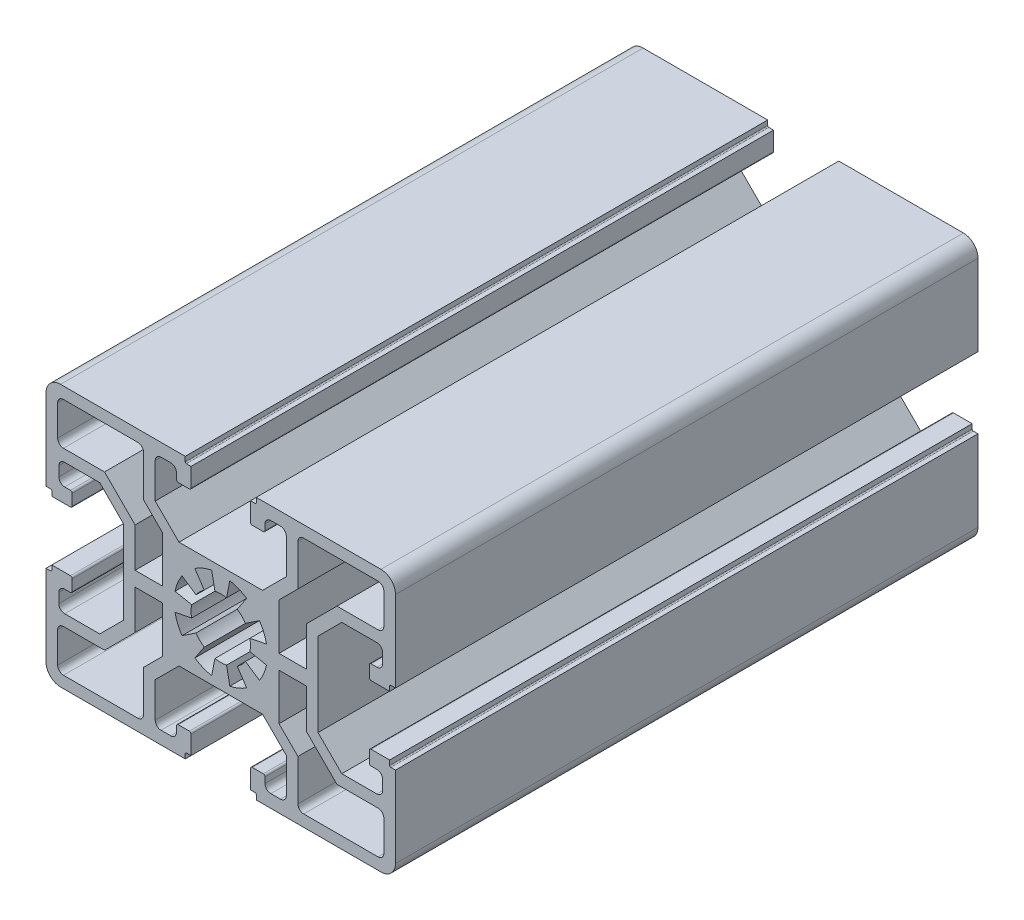
from build123d import *

# Parameters (mm, degrees)
EXTRUDE_1_DEPTH = 100


with BuildPart() as part:
    # 草图1 → 凸台-拉伸1 (new body)
    with BuildSketch(Plane.XY):
        with BuildLine():
            Line((-5.674392903, 22.651402525), (-27.074392903, 22.651402525))
            ThreePointArc((-27.074392903, 22.651402525), (-28.842159856, 21.919169478), (-29.574392903, 20.151402525))
            Line((-29.574392903, 20.151402525), (-29.574392903, 6.251402525))
            Line((-29.574392903, 6.251402525), (-28.774392903, 6.251402525))
            ThreePointArc((-28.774392903, 6.251402525), (-28.632971547, 6.192823881), (-28.574392903, 6.051402525))
            Line((-28.574392903, 6.051402525), (-28.574392903, 5.251402525))
            Line((-28.574392903, 5.251402525), (-25.374392903, 5.251402525))
            ThreePointArc((-25.374392903, 5.251402525), (-25.162260869, 5.33927049), (-25.074392903, 5.551402525))
            Line((-25.074392903, 5.551402525), (-25.074392903, 7.451402525))
            ThreePointArc((-25.074392903, 7.451402525), (-25.162260869, 7.663534559), (-25.374392903, 7.751402525))
            Line((-25.374392903, 7.751402525), (-26.374392903, 7.751402525))
            ThreePointArc((-26.374392903, 7.751402525), (-27.081499684, 8.044295743), (-27.374392903, 8.751402525))
            Line((-27.374392903, 8.751402525), (-27.374392903, 10.401402525))
            ThreePointArc((-27.374392903, 10.401402525), (-27.081499684, 11.108509306), (-26.374392903, 11.401402525))
            Line((-26.374392903, 11.401402525), (-20.352820028, 11.401402525))
            Line((-20.352820028, 11.401402525), (-16.274392903, 7.3229754))
            Line((-16.274392903, 7.3229754), (-16.274392903, 0.151402525))
            Line((-16.274392903, 0.151402525), (-16.274392903, -7.020170351))
            Line((-16.274392903, -7.020170351), (-20.352820028, -11.098597475))
            Line((-20.352820028, -11.098597475), (-26.374392903, -11.098597475))
            ThreePointArc((-26.374392903, -11.098597475), (-27.081499684, -10.805704257), (-27.374392903, -10.098597475))
            Line((-27.374392903, -10.098597475), (-27.374392903, -8.448597475))
            ThreePointArc((-27.374392903, -8.448597475), (-27.081499684, -7.741490694), (-26.374392903, -7.448597475))
            Line((-26.374392903, -7.448597475), (-25.374392903, -7.448597475))
            ThreePointArc((-25.374392903, -7.448597475), (-25.162260869, -7.36072951), (-25.074392903, -7.148597475))
            Line((-25.074392903, -7.148597475), (-25.074392903, -5.248597475))
            ThreePointArc((-25.074392903, -5.248597475), (-25.162260869, -5.036465441), (-25.374392903, -4.948597475))
            Line((-25.374392903, -4.948597475), (-28.574392903, -4.948597475))
            Line((-28.574392903, -4.948597475), (-28.574392903, -5.748597475))
            ThreePointArc((-28.574392903, -5.748597475), (-28.632971547, -5.890018832), (-28.774392903, -5.948597475))
            Line((-28.774392903, -5.948597475), (-29.574392903, -5.948597475))
            Line((-29.574392903, -5.948597475), (-29.574392903, -19.848597475))
            ThreePointArc((-29.574392903, -19.848597475), (-28.842159856, -21.616364428), (-27.074392903, -22.348597475))
            Line((-27.074392903, -22.348597475), (-5.674392903, -22.348597475))
            Line((-5.674392903, -22.348597475), (-5.674392903, -21.548597475))
            ThreePointArc((-5.674392903, -21.548597475), (-5.61581426, -21.407176119), (-5.474392903, -21.348597475))
            Line((-5.474392903, -21.348597475), (-4.674392903, -21.348597475))
            Line((-4.674392903, -21.348597475), (-4.674392903, -18.148597475))
            ThreePointArc((-4.674392903, -18.148597475), (-4.762260869, -17.936465441), (-4.974392903, -17.848597475))
            Line((-4.974392903, -17.848597475), (-6.874392903, -17.848597475))
            ThreePointArc((-6.874392903, -17.848597475), (-7.086524938, -17.936465441), (-7.174392903, -18.148597475))
            Line((-7.174392903, -18.148597475), (-7.174392903, -19.148597475))
            ThreePointArc((-7.174392903, -19.148597475), (-7.467286122, -19.855704257), (-8.174392903, -20.148597475))
            Line((-8.174392903, -20.148597475), (-9.824392903, -20.148597475))
            ThreePointArc((-9.824392903, -20.148597475), (-10.531499684, -19.855704257), (-10.824392903, -19.148597475))
            Line((-10.824392903, -19.148597475), (-10.824392903, -13.1270246))
            Line((-10.824392903, -13.1270246), (-6.745965779, -9.048597475))
            Line((-6.745965779, -9.048597475), (7.597179972, -9.048597475))
            Line((7.597179972, -9.048597475), (11.675607097, -13.1270246))
            Line((11.675607097, -13.1270246), (11.675607097, -19.148597475))
            ThreePointArc((11.675607097, -19.148597475), (11.382713878, -19.855704257), (10.675607097, -20.148597475))
            Line((10.675607097, -20.148597475), (9.025607097, -20.148597475))
            ThreePointArc((9.025607097, -20.148597475), (8.318500316, -19.855704257), (8.025607097, -19.148597475))
            Line((8.025607097, -19.148597475), (8.025607097, -18.148597475))
            ThreePointArc((8.025607097, -18.148597475), (7.937739131, -17.936465441), (7.725607097, -17.848597475))
            Line((7.725607097, -17.848597475), (5.825607097, -17.848597475))
            ThreePointArc((5.825607097, -17.848597475), (5.613475062, -17.936465441), (5.525607097, -18.148597475))
            Line((5.525607097, -18.148597475), (5.525607097, -21.348597475))
            Line((5.525607097, -21.348597475), (6.325607097, -21.348597475))
            ThreePointArc((6.325607097, -21.348597475), (6.467028453, -21.407176119), (6.525607097, -21.548597475))
            Line((6.525607097, -21.548597475), (6.525607097, -22.348597475))
            Line((6.525607097, -22.348597475), (27.925607097, -22.348597475))
            ThreePointArc((27.925607097, -22.348597475), (29.69337405, -21.616364428), (30.425607097, -19.848597475))
            Line((30.425607097, -19.848597475), (30.425607097, -5.948597475))
            Line((30.425607097, -5.948597475), (29.625607097, -5.948597475))
            ThreePointArc((29.625607097, -5.948597475), (29.484185741, -5.890018832), (29.425607097, -5.748597475))
            Line((29.425607097, -5.748597475), (29.425607097, -4.948597475))
            Line((29.425607097, -4.948597475), (26.225607097, -4.948597475))
            ThreePointArc((26.225607097, -4.948597475), (26.013475062, -5.036465441), (25.925607097, -5.248597475))
            Line((25.925607097, -5.248597475), (25.925607097, -7.148597475))
            ThreePointArc((25.925607097, -7.148597475), (26.013475062, -7.36072951), (26.225607097, -7.448597475))
            Line((26.225607097, -7.448597475), (27.225607097, -7.448597475))
            ThreePointArc((27.225607097, -7.448597475), (27.932713878, -7.741490694), (28.225607097, -8.448597475))
            Line((28.225607097, -8.448597475), (28.225607097, -10.098597475))
            ThreePointArc((28.225607097, -10.098597475), (27.932713878, -10.805704257), (27.225607097, -11.098597475))
            Line((27.225607097, -11.098597475), (21.204034221, -11.098597475))
            Line((21.204034221, -11.098597475), (17.125607097, -7.020170351))
            Line((17.125607097, -7.020170351), (17.125607097, 0.151402525))
            Line((17.125607097, 0.151402525), (17.125607097, 7.3229754))
            Line((17.125607097, 7.3229754), (21.204034221, 11.401402525))
            Line((21.204034221, 11.401402525), (27.225607097, 11.401402525))
            ThreePointArc((27.225607097, 11.401402525), (27.932713878, 11.108509306), (28.225607097, 10.401402525))
            Line((28.225607097, 10.401402525), (28.225607097, 8.751402525))
            ThreePointArc((28.225607097, 8.751402525), (27.932713878, 8.044295743), (27.225607097, 7.751402525))
            Line((27.225607097, 7.751402525), (26.225607097, 7.751402525))
            ThreePointArc((26.225607097, 7.751402525), (26.013475062, 7.663534559), (25.925607097, 7.451402525))
            Line((25.925607097, 7.451402525), (25.925607097, 5.551402525))
            ThreePointArc((25.925607097, 5.551402525), (26.013475062, 5.33927049), (26.225607097, 5.251402525))
            Line((26.225607097, 5.251402525), (29.425607097, 5.251402525))
            Line((29.425607097, 5.251402525), (29.425607097, 6.051402525))
            ThreePointArc((29.425607097, 6.051402525), (29.484185741, 6.192823881), (29.625607097, 6.251402525))
            Line((29.625607097, 6.251402525), (30.425607097, 6.251402525))
            Line((30.425607097, 6.251402525), (30.425607097, 20.151402525))
            ThreePointArc((30.425607097, 20.151402525), (29.69337405, 21.919169478), (27.925607097, 22.651402525))
            Line((27.925607097, 22.651402525), (6.525607097, 22.651402525))
            Line((6.525607097, 22.651402525), (6.525607097, 21.851402525))
            ThreePointArc((6.525607097, 21.851402525), (6.467028453, 21.709981168), (6.325607097, 21.651402525))
            Line((6.325607097, 21.651402525), (5.525607097, 21.651402525))
            Line((5.525607097, 21.651402525), (5.525607097, 18.451402525))
            ThreePointArc((5.525607097, 18.451402525), (5.613475062, 18.23927049), (5.825607097, 18.151402525))
            Line((5.825607097, 18.151402525), (7.725607097, 18.151402525))
            ThreePointArc((7.725607097, 18.151402525), (7.937739131, 18.23927049), (8.025607097, 18.451402525))
            Line((8.025607097, 18.451402525), (8.025607097, 19.451402525))
            ThreePointArc((8.025607097, 19.451402525), (8.318500316, 20.158509306), (9.025607097, 20.451402525))
            Line((9.025607097, 20.451402525), (10.675607097, 20.451402525))
            ThreePointArc((10.675607097, 20.451402525), (11.382713878, 20.158509306), (11.675607097, 19.451402525))
            Line((11.675607097, 19.451402525), (11.675607097, 13.429829649))
            Line((11.675607097, 13.429829649), (7.597179972, 9.351402525))
            Line((7.597179972, 9.351402525), (-6.745965779, 9.351402525))
            Line((-6.745965779, 9.351402525), (-10.824392903, 13.429829649))
            Line((-10.824392903, 13.429829649), (-10.824392903, 19.451402525))
            ThreePointArc((-10.824392903, 19.451402525), (-10.531499684, 20.158509306), (-9.824392903, 20.451402525))
            Line((-9.824392903, 20.451402525), (-8.174392903, 20.451402525))
            ThreePointArc((-8.174392903, 20.451402525), (-7.467286122, 20.158509306), (-7.174392903, 19.451402525))
            Line((-7.174392903, 19.451402525), (-7.174392903, 18.451402525))
            ThreePointArc((-7.174392903, 18.451402525), (-7.086524938, 18.23927049), (-6.874392903, 18.151402525))
            Line((-6.874392903, 18.151402525), (-4.974392903, 18.151402525))
            ThreePointArc((-4.974392903, 18.151402525), (-4.762260869, 18.23927049), (-4.674392903, 18.451402525))
            Line((-4.674392903, 18.451402525), (-4.674392903, 21.651402525))
            Line((-4.674392903, 21.651402525), (-5.474392903, 21.651402525))
            ThreePointArc((-5.474392903, 21.651402525), (-5.615814259, 21.709981168), (-5.674392903, 21.851402525))
            Line((-5.674392903, 21.851402525), (-5.674392903, 22.651402525))
        make_face()
        with BuildLine():
            Line((-14.274392903, 8.151402525), (-14.274392903, 1.401402525))
            Line((-14.274392903, 1.401402525), (-9.574392903, 1.401402525))
            Line((-9.574392903, 1.401402525), (-9.574392903, 9.351402525))
            Line((-9.574392903, 9.351402525), (-12.824392903, 12.601402525))
            Line((-12.824392903, 12.601402525), (-12.824392903, 19.651402525))
            ThreePointArc((-12.824392903, 19.651402525), (-13.117286122, 20.358509306), (-13.824392903, 20.651402525))
            Line((-13.824392903, 20.651402525), (-26.574392903, 20.651402525))
            ThreePointArc((-26.574392903, 20.651402525), (-27.281499684, 20.358509306), (-27.574392903, 19.651402525))
            Line((-27.574392903, 19.651402525), (-27.574392903, 14.401402525))
            ThreePointArc((-27.574392903, 14.401402525), (-27.281499684, 13.694295743), (-26.574392903, 13.401402525))
            Line((-26.574392903, 13.401402525), (-19.524392903, 13.401402525))
            Line((-19.524392903, 13.401402525), (-14.274392903, 8.151402525))
        make_face(mode=Mode.SUBTRACT)
        with BuildLine():
            Line((7.077363995, 4.595964389), (4.666102119, 2.984810713))
            ThreePointArc((4.666102119, 2.984810713), (4.031851681, 3.757647109), (3.259015285, 4.391897547))
            Line((3.259015285, 4.391897547), (4.870168961, 6.803159423))
            ThreePointArc((4.870168961, 6.803159423), (3.487074556, 7.542438785), (1.986329673, 7.997684768))
            Line((1.986329673, 7.997684768), (1.420567739, 5.153407455))
            ThreePointArc((1.420567739, 5.153407455), (0.425607097, 5.251402525), (-0.569353546, 5.153407455))
            Line((-0.569353546, 5.153407455), (-1.135115479, 7.997684768))
            ThreePointArc((-1.135115479, 7.997684768), (-2.635860362, 7.542438785), (-4.018954767, 6.803159423))
            Line((-4.018954767, 6.803159423), (-2.407801092, 4.391897547))
            ThreePointArc((-2.407801092, 4.391897547), (-3.180637487, 3.757647109), (-3.814887926, 2.984810713))
            Line((-3.814887926, 2.984810713), (-6.226149802, 4.595964389))
            ThreePointArc((-6.226149802, 4.595964389), (-6.965429163, 3.212869983), (-7.420675146, 1.712125101))
            Line((-7.420675146, 1.712125101), (-4.576397833, 1.146363167))
            ThreePointArc((-4.576397833, 1.146363167), (-4.674392903, 0.151402525), (-4.576397833, -0.843558118))
            Line((-4.576397833, -0.843558118), (-7.420675146, -1.409320052))
            ThreePointArc((-7.420675146, -1.409320052), (-6.965429163, -2.910064934), (-6.226149802, -4.29315934))
            Line((-6.226149802, -4.29315934), (-3.814887926, -2.682005664))
            ThreePointArc((-3.814887926, -2.682005664), (-3.180637487, -3.45484206), (-2.407801092, -4.089092498))
            Line((-2.407801092, -4.089092498), (-4.018954767, -6.500354374))
            ThreePointArc((-4.018954767, -6.500354374), (-2.635860362, -7.239633736), (-1.135115479, -7.694879719))
            Line((-1.135115479, -7.694879719), (-0.569353546, -4.850602406))
            ThreePointArc((-0.569353546, -4.850602406), (0.425607097, -4.948597475), (1.420567739, -4.850602406))
            Line((1.420567739, -4.850602406), (1.986329673, -7.694879719))
            ThreePointArc((1.986329673, -7.694879719), (3.487074556, -7.239633736), (4.870168961, -6.500354374))
            Line((4.870168961, -6.500354374), (3.259015285, -4.089092498))
            ThreePointArc((3.259015285, -4.089092498), (4.031851681, -3.45484206), (4.666102119, -2.682005664))
            Line((4.666102119, -2.682005664), (7.077363995, -4.29315934))
            ThreePointArc((7.077363995, -4.29315934), (7.816643357, -2.910064934), (8.27188934, -1.409320052))
            Line((8.27188934, -1.409320052), (5.427612027, -0.843558118))
            ThreePointArc((5.427612027, -0.843558118), (5.525607097, 0.151402525), (5.427612027, 1.146363167))
            Line((5.427612027, 1.146363167), (8.27188934, 1.712125101))
            ThreePointArc((8.27188934, 1.712125101), (7.816643357, 3.212869983), (7.077363995, 4.595964389))
        make_face(mode=Mode.SUBTRACT)
        with BuildLine():
            Line((15.125607097, 8.151402525), (15.125607097, 1.401402525))
            Line((15.125607097, 1.401402525), (10.425607097, 1.401402525))
            Line((10.425607097, 1.401402525), (10.425607097, 9.351402525))
            Line((10.425607097, 9.351402525), (13.675607097, 12.601402525))
            Line((13.675607097, 12.601402525), (13.675607097, 19.651402525))
            ThreePointArc((13.675607097, 19.651402525), (13.968500316, 20.358509306), (14.675607097, 20.651402525))
            Line((14.675607097, 20.651402525), (27.425607097, 20.651402525))
            ThreePointArc((27.425607097, 20.651402525), (28.132713878, 20.358509306), (28.425607097, 19.651402525))
            Line((28.425607097, 19.651402525), (28.425607097, 14.401402525))
            ThreePointArc((28.425607097, 14.401402525), (28.132713878, 13.694295743), (27.425607097, 13.401402525))
            Line((27.425607097, 13.401402525), (20.375607097, 13.401402525))
            Line((20.375607097, 13.401402525), (15.125607097, 8.151402525))
        make_face(mode=Mode.SUBTRACT)
        with BuildLine():
            Line((-14.274392903, -7.848597475), (-14.274392903, -1.098597475))
            Line((-14.274392903, -1.098597475), (-9.574392903, -1.098597475))
            Line((-9.574392903, -1.098597475), (-9.574392903, -9.048597475))
            Line((-9.574392903, -9.048597475), (-12.824392903, -12.298597475))
            Line((-12.824392903, -12.298597475), (-12.824392903, -19.348597475))
            ThreePointArc((-12.824392903, -19.348597475), (-13.117286122, -20.055704257), (-13.824392903, -20.348597475))
            Line((-13.824392903, -20.348597475), (-26.574392903, -20.348597475))
            ThreePointArc((-26.574392903, -20.348597475), (-27.281499684, -20.055704257), (-27.574392903, -19.348597475))
            Line((-27.574392903, -19.348597475), (-27.574392903, -14.098597475))
            ThreePointArc((-27.574392903, -14.098597475), (-27.281499684, -13.391490694), (-26.574392903, -13.098597475))
            Line((-26.574392903, -13.098597475), (-19.524392903, -13.098597475))
            Line((-19.524392903, -13.098597475), (-14.274392903, -7.848597475))
        make_face(mode=Mode.SUBTRACT)
        with BuildLine():
            Line((15.125607097, -7.848597475), (15.125607097, -1.098597475))
            Line((15.125607097, -1.098597475), (10.425607097, -1.098597475))
            Line((10.425607097, -1.098597475), (10.425607097, -9.048597475))
            Line((10.425607097, -9.048597475), (13.675607097, -12.298597475))
            Line((13.675607097, -12.298597475), (13.675607097, -19.348597475))
            ThreePointArc((13.675607097, -19.348597475), (13.968500316, -20.055704257), (14.675607097, -20.348597475))
            Line((14.675607097, -20.348597475), (27.425607097, -20.348597475))
            ThreePointArc((27.425607097, -20.348597475), (28.132713878, -20.055704257), (28.425607097, -19.348597475))
            Line((28.425607097, -19.348597475), (28.425607097, -14.098597475))
            ThreePointArc((28.425607097, -14.098597475), (28.132713878, -13.391490694), (27.425607097, -13.098597475))
            Line((27.425607097, -13.098597475), (20.375607097, -13.098597475))
            Line((20.375607097, -13.098597475), (15.125607097, -7.848597475))
        make_face(mode=Mode.SUBTRACT)
    extrude(amount=EXTRUDE_1_DEPTH)


solid = part.part
